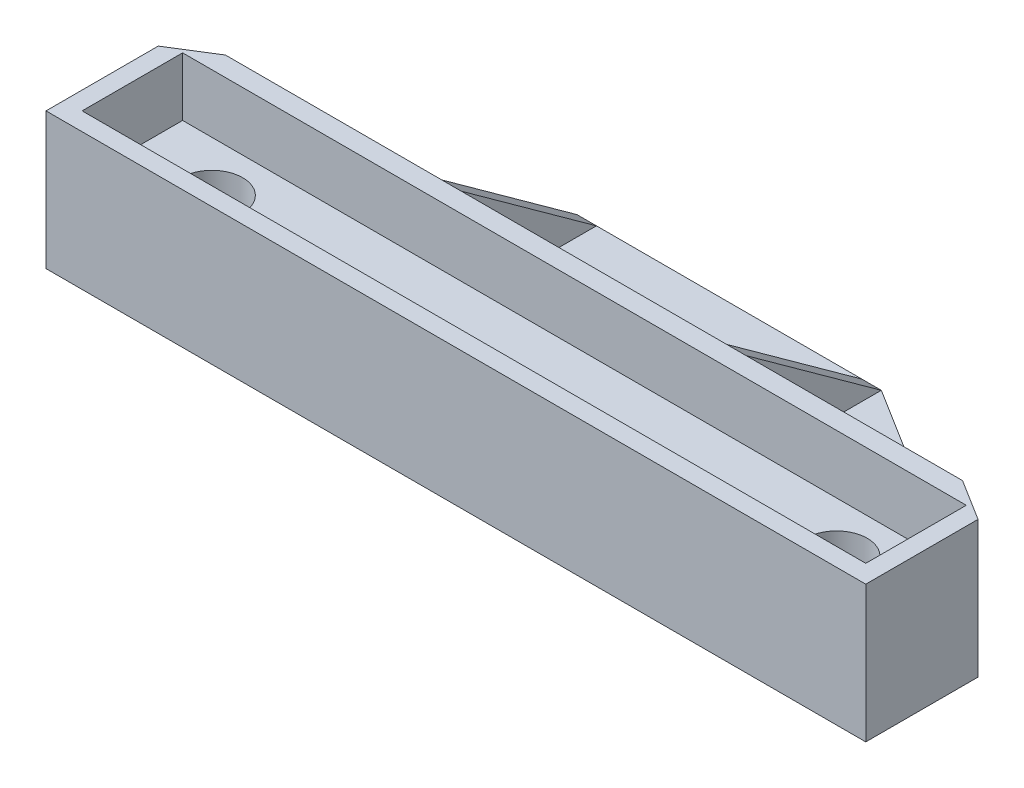
from build123d import *

# Parameters (mm, degrees)
RISER_DEPTH             = 7
SKETCH2_R               = 1.575
MOUNTING_HOLES_DEPTH    = 24.216373532
SKETCH3_W               = 40.15
SKETCH3_H               = 5.15
RECESS_DEPTH            = 3
FLANGE_DEPTH            = 7
SKETCH5_W               = 13.594480272
SKETCH5_H               = 6.925
FLANGE_CUTOUT_DEPTH     = 5
ANGLE_CUTOUT_DEPTH      = 32.901199964
ANGLE_CUTOUT_DEPTH_BACK = 32.901199964
FLANGE_CHAMFER_SIZE     = 1


with BuildPart() as part:
    # Sketch1 → Riser (new body)
    with BuildSketch(Plane(origin=(0, 0, 0), x_dir=(1, 0, 0), z_dir=(0, 1, 0))):
        Polygon((-18.999581839, 7), (18.999581839, 7), (21, 5.75), (21, 0), (-21, 0), (-21, 5.75), align=None)
    extrude(amount=RISER_DEPTH)

    # Sketch2 → Mounting Holes (cut, through all)
    with BuildSketch(Plane.XZ):
        with Locations(Location((16, -3.5, 0), (0, 0, 270))):
            Circle(SKETCH2_R)
        with Locations(Location((-16, -3.5, 0), (0, 0, 90))):
            Circle(SKETCH2_R)
    extrude(amount=-MOUNTING_HOLES_DEPTH, mode=Mode.SUBTRACT)

    # Sketch3 → Recess (cut)
    with BuildSketch(Plane(origin=(0, 7, 0), x_dir=(1, 0, 0), z_dir=(0, 1, 0))):
        with Locations((0, 3.5)):
            Rectangle(SKETCH3_W, SKETCH3_H)
    extrude(amount=-RECESS_DEPTH, mode=Mode.SUBTRACT)

    # Sketch4 → Flange (add)
    with BuildSketch(Plane(origin=(0, 0, 0), x_dir=(1, 0, 0), z_dir=(0, 1, 0))):
        Polygon((-18.999581839, 7), (18.999581839, 7), (7.797240136, 14), (-7.797240136, 14), align=None)
    extrude(amount=FLANGE_DEPTH)

    # Sketch5 → Flange Cutout (cut)
    with BuildSketch(Plane(origin=(0, 7, 0), x_dir=(1, 0, 0), z_dir=(0, 1, 0))):
        with Locations((0, 10.5375)):
            Rectangle(SKETCH5_W, SKETCH5_H)
        Polygon((-18.879556749, 7.075), (-7.797240136, 7.075), (-7.797240136, 14), align=None)
        Polygon((7.797240136, 7.075), (7.797240136, 14), (18.879556749, 7.075), align=None)
    extrude(amount=-FLANGE_CUTOUT_DEPTH, mode=Mode.SUBTRACT)

    # Sketch7 → Angle Cutout (cut, two sides: drawn at the far end of the back side and taken through both)
    with BuildSketch(Plane.ZY.offset(-6.797240136).offset(-ANGLE_CUTOUT_DEPTH_BACK)):
        Polygon((-7.075, 7), (-14, 2), (-14, 7), align=None)
    extrude(amount=ANGLE_CUTOUT_DEPTH + ANGLE_CUTOUT_DEPTH_BACK, mode=Mode.SUBTRACT)

    # Flange Chamfer
    flange_chamfer_edges = [part.edges().sort_by_distance(p)[0] for p in [
        (13.338398442, 2, -7.075),
        (-13.338398442, 2, -7.075),
        (0, 2, -7.075),
    ]]
    chamfer(flange_chamfer_edges, length=FLANGE_CHAMFER_SIZE)


solid = part.part
